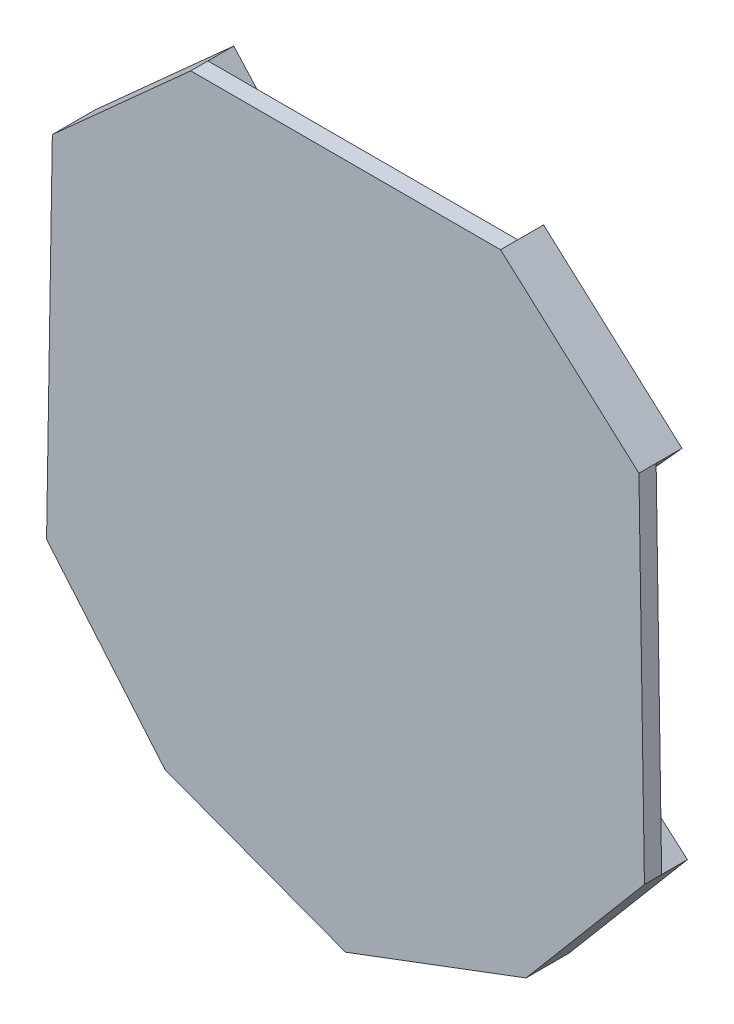
from build123d import *

# Parameters (mm, degrees)
BOSS_EXTRU_1_DEPTH   = 1.5
BOSS_EXTRU_1_2_DEPTH = 1.5
BOSS_EXTRU_1_3_DEPTH = 1.5
BOSS_EXTRU_1_4_DEPTH = 1.5
BOSS_EXTRU_1_5_DEPTH = 1.5
BOSS_EXTRU_1_6_DEPTH = 1.5
BOSS_EXTRU_2_DEPTH   = 1


with BuildPart() as part:
    # Esquisse1 → Boss.-Extru.1 (new body)
    with BuildSketch(Plane.XY):
        Polygon((-176.800264215, -47.339338477), (-184.843723767, -54.566794886), (-181.118447951, -58.712666358), (-173.074988399, -51.485209949), align=None)
    extrude(amount=BOSS_EXTRU_1_DEPTH)



with BuildPart() as body_2:
    # Esquisse1 → Boss.-Extru.1 2 (new body)
    with BuildSketch(Plane.XY):
        Polygon((-162.519339525, -51.485209949), (-158.794063709, -47.339338477), (-150.750604157, -54.566794886), (-154.475879973, -58.712666358), align=None)
    extrude(amount=BOSS_EXTRU_1_2_DEPTH)


with BuildPart() as body_3:
    # Esquisse1 → Boss.-Extru.1 3 (new body)
    with BuildSketch(Plane.XY):
        Polygon((-167.797163962, -50.848552985), (-182.022085707, -63.620897312), (-173.35401557, -64.417824785), (-167.797163962, -59.428410897), (-162.240312354, -64.417824785), (-153.572242217, -63.620897312), align=None)
    extrude(amount=BOSS_EXTRU_1_3_DEPTH)


with BuildPart() as body_4:
    # Esquisse1 → Boss.-Extru.1 4 (new body)
    with BuildSketch(Plane.XY):
        Polygon((-150.431114161, -75.10841244), (-153.688231039, -72.266347409), (-160.062329499, -80.936704941), (-157.314858031, -83.257550404), align=None)
    extrude(amount=BOSS_EXTRU_1_4_DEPTH)


with BuildPart() as body_5:
    # Esquisse1 → Boss.-Extru.1 5 (new body)
    with BuildSketch(Plane.XY):
        Polygon((-153.334476349, -66.363856576), (-162.055800616, -67.165680142), (-167.80522325, -75.681790853), (-173.554645883, -67.165680142), (-182.27597015, -66.363856576), (-167.80522325, -87.201623391), align=None)
    extrude(amount=BOSS_EXTRU_1_5_DEPTH)


with BuildPart() as body_6:
    # Esquisse1 → Boss.-Extru.1 6 (new body)
    with BuildSketch(Plane.XY):
        Polygon((-181.92221546, -72.266347409), (-175.548117001, -80.936704941), (-178.295588468, -83.257550404), (-185.179332338, -75.10841244), align=None)
    extrude(amount=BOSS_EXTRU_1_6_DEPTH)


with BuildPart() as part_1:
    add(part.part)

    add(body_2.part)  # Boss.-Extru.2 merges body 2

    add(body_3.part)  # Boss.-Extru.2 merges body 3

    add(body_4.part)  # Boss.-Extru.2 merges body 4

    add(body_5.part)  # Boss.-Extru.2 merges body 5

    add(body_6.part)  # Boss.-Extru.2 merges body 6
    # Esquisse2 → Boss.-Extru.2 (add)
    with BuildSketch(Plane.XY.offset(1.5)):
        Polygon((-176.800264215, -47.339338477), (-158.794063709, -47.339338477), (-150.750604157, -54.566794886), (-150.431114161, -75.10841244), (-157.314858031, -83.257550404), (-167.80522325, -87.201623391), (-178.295588468, -83.257550404), (-185.179332338, -75.10841244), (-184.843723767, -54.566794886), align=None)
    extrude(amount=BOSS_EXTRU_2_DEPTH)


solid = part_1.part
